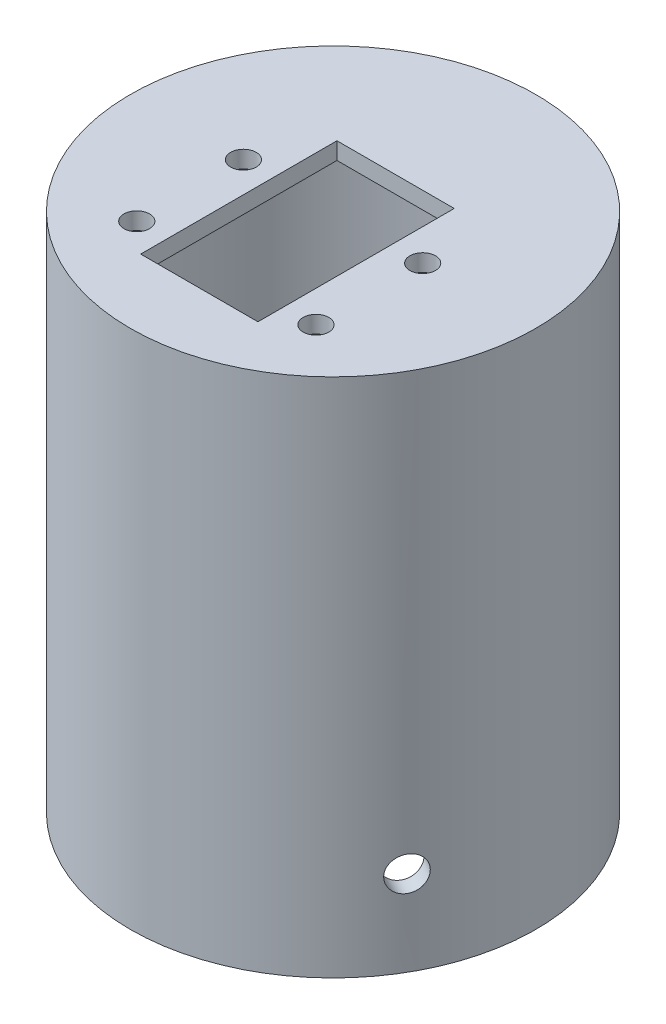
from build123d import *

# Parameters (mm, degrees)
SKETCH1_R               = 23.75
SKETCH1_R_2             = 21.75
BOSS_EXTRUDE1_DEPTH     = 59
SKETCH2_R               = 23.75
BOSS_EXTRUDE2_DEPTH     = 2
SKETCH3_R               = 1.5
CUT_EXTRUDE1_DEPTH      = 2
CUT_EXTRUDE2_REACH      = 71.636
CUT_EXTRUDE2_END_RADIUS = 23.75
SKETCH4_R               = 2
CIRPATTERN1_COUNT       = 3


with BuildPart() as part:
    # Sketch1 → Boss-Extrude1 (new body)
    with BuildSketch(Plane(origin=(0, 0, 0), x_dir=(1, 0, 0), z_dir=(0, 1, 0))):
        with Locations(Location((0, 0, 0), (0, 0, 270))):
            Circle(SKETCH1_R)
        with Locations(Location((0, 0, 0), (0, 0, 270))):
            Circle(SKETCH1_R_2, mode=Mode.SUBTRACT)
    extrude(amount=BOSS_EXTRUDE1_DEPTH)

    # Sketch2 → Boss-Extrude2 (add)
    with BuildSketch(Plane(origin=(0, 59, 0), x_dir=(1, 0, 0), z_dir=(0, 1, 0))):
        with Locations(Location((0, 0, 0), (0, 0, 270))):
            Circle(SKETCH2_R)
    extrude(amount=BOSS_EXTRUDE2_DEPTH)

    # Sketch3 → Cut-Extrude1 (cut)
    with BuildSketch(Plane(origin=(0, 61, 0), x_dir=(1, 0, 0), z_dir=(0, 1, 0))):
        with Locations(Location((-10.5, 0, 0), (0, 0, 270))):
            Circle(SKETCH3_R)
        with Locations(Location((10.5, 0, 0), (0, 0, 270))):
            Circle(SKETCH3_R)
        with Locations(Location((-10.5, -12.5, 0), (0, 0, 270))):
            Circle(SKETCH3_R)
        with Locations(Location((10.5, -12.5, 0), (0, 0, 270))):
            Circle(SKETCH3_R)
        Polygon((0, 7.4), (6.8, 7.4), (6.8, -15.6), (-6.94269124, -15.6), (-6.94269124, 7.4), align=None)
    extrude(amount=-CUT_EXTRUDE1_DEPTH, mode=Mode.SUBTRACT)

    # Cut-Extrude2: up to this cylinder (the profile starts inside it)
    cut_extrude2_end = Plane(origin=(0, 10, 0), z_dir=(0, -1, 0)) * Cylinder(CUT_EXTRUDE2_END_RADIUS, 191.772, mode=Mode.PRIVATE)
    # Sketch4 → Cut-Extrude2 (cut, up to the surface)
    with BuildSketch(Plane.XY, mode=Mode.PRIVATE) as cut_extrude2_sk1:
        with Locations((0, 10)):
            Circle(SKETCH4_R)
    cut_extrude2_tool1 = extrude(cut_extrude2_sk1.sketch, amount=-CUT_EXTRUDE2_REACH, mode=Mode.PRIVATE) & cut_extrude2_end
    cut_extrude2 = cut_extrude2_tool1.solids().sort_by_distance((0, 10, 0))[0]
    add(cut_extrude2, mode=Mode.SUBTRACT)

    # CirPattern1: Cut-Extrude2 ×3 about axis
    cirpattern1_axis = Axis((0, 59, 0), (0, -1, 0))
    for i in range(1, CIRPATTERN1_COUNT):
        add(cut_extrude2.rotate(cirpattern1_axis, i * 360 / CIRPATTERN1_COUNT), mode=Mode.SUBTRACT)


solid = part.part
